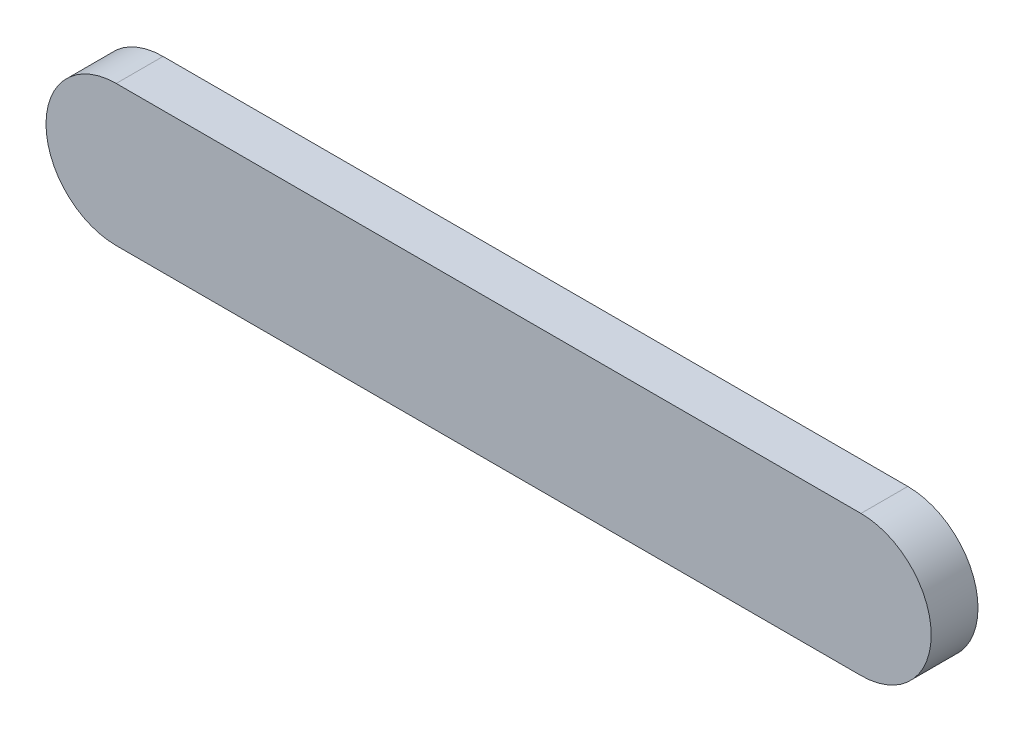
from build123d import *

# Parameters (mm, degrees)
EXTRUDE_1_DEPTH      = 10
EXTRUDE_1_DEPTH_BACK = 10


with BuildPart() as part:
    # 草图1 → 凸台-拉伸1 (new, two sides: drawn at the far end of the back side and taken through both)
    with BuildSketch(Plane.XY.offset(-EXTRUDE_1_DEPTH_BACK)):
        with BuildLine():
            Line((159.099025767, 30), (-159.099025767, 30))
            ThreePointArc((-159.099025767, 30), (-189.099025767, 0), (-159.099025767, -30))
            Line((-159.099025767, -30), (159.099025767, -30))
            ThreePointArc((159.099025767, -30), (189.099025767, 0), (159.099025767, 30))
        make_face()
    extrude(amount=EXTRUDE_1_DEPTH + EXTRUDE_1_DEPTH_BACK)


solid = part.part
